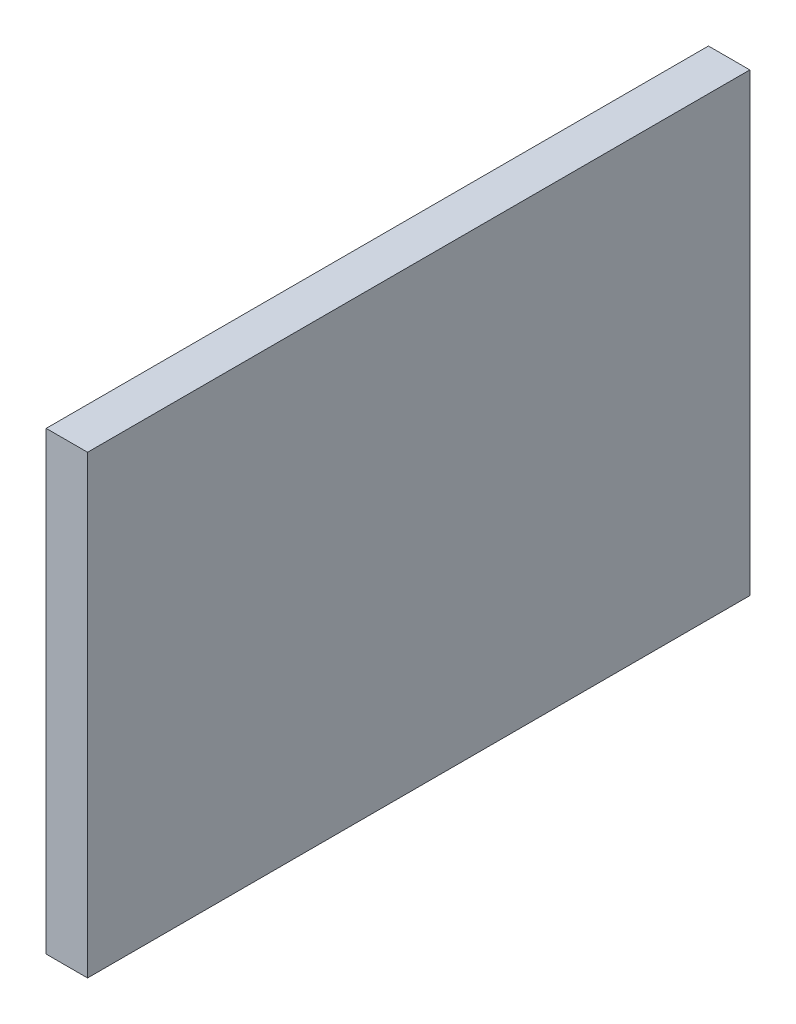
from build123d import *

# Parameters (mm, degrees)
SKETCH1_W           = 160
SKETCH1_H           = 110
BOSS_EXTRUDE1_DEPTH = 10


with BuildPart() as part:
    # Sketch1 → Boss-Extrude1 (new body)
    with BuildSketch(Plane(origin=(0, 0, 0), x_dir=(0, 0, -1), z_dir=(1, 0, 0))):
        Rectangle(SKETCH1_W, SKETCH1_H)
    extrude(amount=BOSS_EXTRUDE1_DEPTH)


solid = part.part
